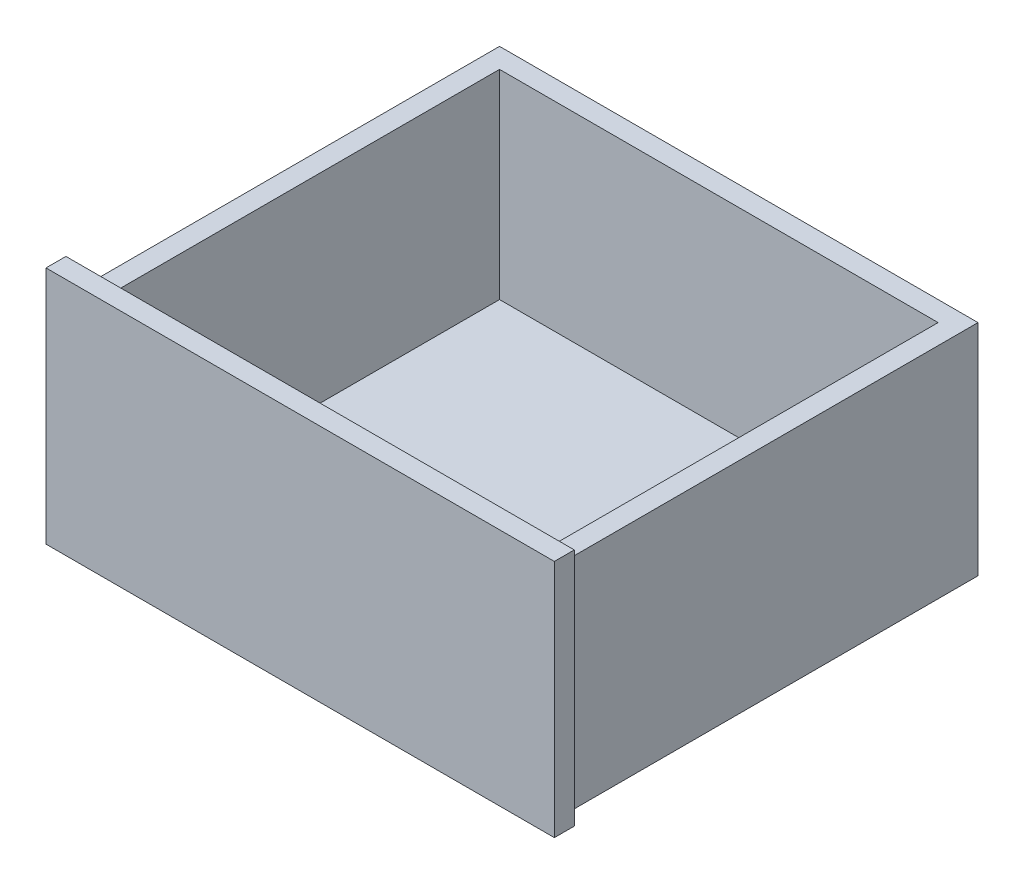
from build123d import *

# Parameters (mm, degrees)
SKETCH1_W           = 64.77
SKETCH1_H           = 30.48
BOSS_EXTRUDE1_DEPTH = 2.54
SKETCH2_W           = 60.96
SKETCH2_H           = 53.34
BOSS_EXTRUDE2_DEPTH = 2.54
BOSS_EXTRUDE4_DEPTH = 25.4


with BuildPart() as part:
    # Sketch1 → Boss-Extrude1 (new body)
    with BuildSketch(Plane.XY):
        Rectangle(SKETCH1_W, SKETCH1_H)
    extrude(amount=BOSS_EXTRUDE1_DEPTH)



with BuildPart() as body_2:
    # Sketch2 → Boss-Extrude2 (new body)
    with BuildSketch(Plane.XZ.offset(15.24)):
        with Locations((0, -26.67)):
            Rectangle(SKETCH2_W, SKETCH2_H)
    extrude(amount=-BOSS_EXTRUDE2_DEPTH)


with BuildPart() as part_1:
    add(part.part)

    add(body_2.part)  # Boss-Extrude4 merges body 2
    # Sketch3 → Boss-Extrude4 (add)
    with BuildSketch(Plane(origin=(0, -12.7, 0), x_dir=(-1, 0, 0), z_dir=(0, -1, 0))):
        Polygon((27.94, 50.8), (27.94, 0), (30.48, 0), (30.48, 53.34), (-30.48, 53.34), (-30.48, 0), (-27.94, 0), (-27.94, 50.8), align=None)
    extrude(amount=-BOSS_EXTRUDE4_DEPTH)


solid = part_1.part
